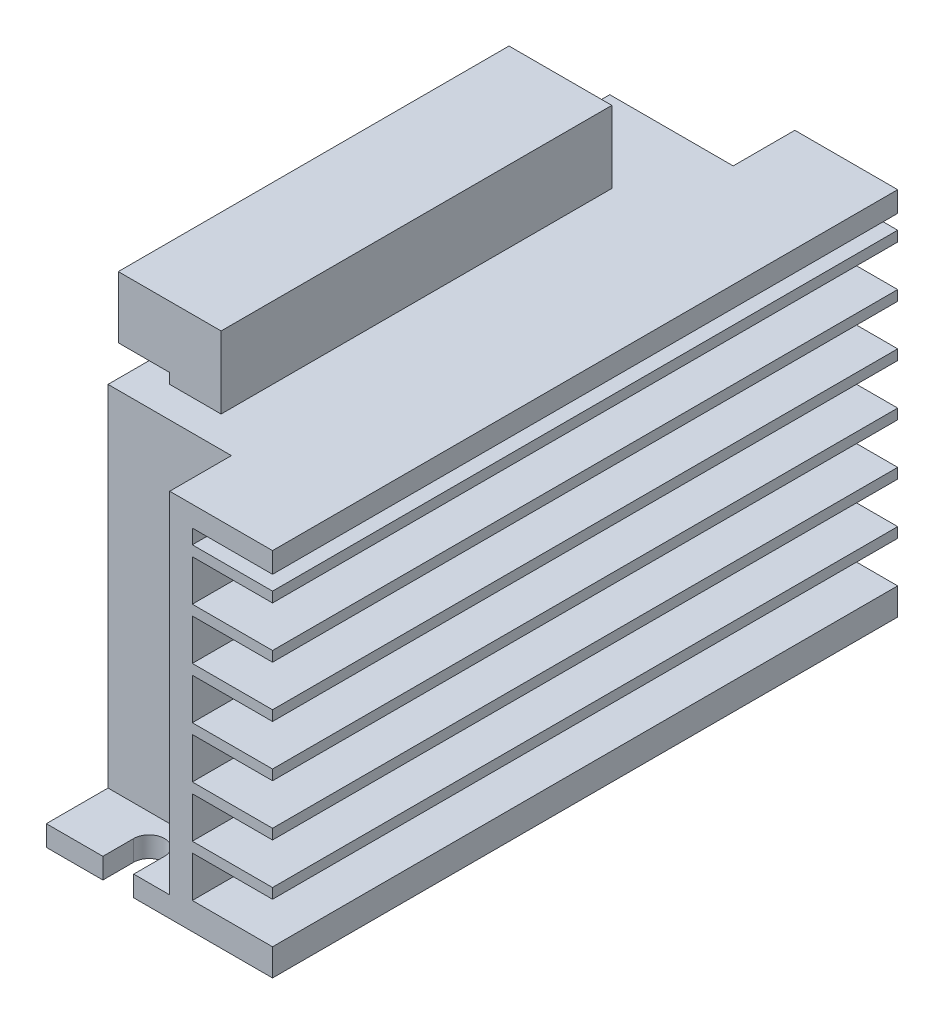
from build123d import *

# Parameters (mm, degrees)
BOSS_EXTRUDE1_DEPTH = 57.15
SKETCH2_W           = 19.05
SKETCH2_H           = 53.975
CUT_EXTRUDE1_DEPTH  = 9.525
SKETCH4_W           = 19.05
SKETCH4_H           = 53.975
CUT_EXTRUDE2_DEPTH  = 9.525
SKETCH5_W           = 12.384603188
SKETCH5_H           = 6.35
SKETCH5_H_2         = 2.244857945
CUT_EXTRUDE3_DEPTH  = 96.52
SKETCH6_W           = 7.9375
SKETCH6_H           = 60.325
BOSS_EXTRUDE2_DEPTH = 1.5875
SKETCH7_W           = 15.875
SKETCH7_H           = 60.325
BOSS_EXTRUDE3_DEPTH = 9.525


with BuildPart() as part:
    # Sketch1 → Boss-Extrude1 (new body)
    with BuildSketch(Plane(origin=(0, 0, 0), x_dir=(1, 0, 0), z_dir=(0, 1, 0))):
        with BuildLine():
            Line((0, 0), (8.73125, 0))
            Line((8.73125, 0), (8.73125, 4.7625))
            ThreePointArc((8.73125, 4.7625), (11.1125, 7.14375), (13.49375, 4.7625))
            Line((13.49375, 4.7625), (13.49375, 0))
            Line((13.49375, 0), (34.925, 0))
            Line((34.925, 0), (34.925, 96.52))
            Line((34.925, 96.52), (13.49375, 96.52))
            Line((13.49375, 96.52), (13.49375, 91.7575))
            ThreePointArc((13.49375, 91.7575), (11.1125, 89.37625), (8.73125, 91.7575))
            Line((8.73125, 91.7575), (8.73125, 96.52))
            Line((8.73125, 96.52), (0, 96.52))
            Line((0, 96.52), (0, 0))
        make_face()
    extrude(amount=BOSS_EXTRUDE1_DEPTH)

    # Sketch2 → Cut-Extrude1 (cut)
    with BuildSketch(Plane.XY):
        with Locations((9.525, 30.1625)):
            Rectangle(SKETCH2_W, SKETCH2_H)
    extrude(amount=-CUT_EXTRUDE1_DEPTH, mode=Mode.SUBTRACT)

    # Sketch4 → Cut-Extrude2 (cut)
    with BuildSketch(Plane(origin=(0, 0, -96.52), x_dir=(-1, 0, 0), z_dir=(0, 0, -1))):
        with Locations((-9.525, 30.1625)):
            Rectangle(SKETCH4_W, SKETCH4_H)
    extrude(amount=-CUT_EXTRUDE2_DEPTH, mode=Mode.SUBTRACT)

    # Sketch5 → Cut-Extrude3 (cut)
    with BuildSketch(Plane(origin=(0, 0, -96.52), x_dir=(-1, 0, 0), z_dir=(0, 0, -1))):
        with Locations((-28.732698406, 7.349133021)):
            Rectangle(SKETCH5_W, SKETCH5_H)
        with Locations((-28.732698406, 15.272834828)):
            Rectangle(SKETCH5_W, SKETCH5_H)
        with Locations((-28.732698406, 23.196536634)):
            Rectangle(SKETCH5_W, SKETCH5_H)
        with Locations((-28.732698406, 31.120238441)):
            Rectangle(SKETCH5_W, SKETCH5_H)
        with Locations((-28.732698406, 39.043940248)):
            Rectangle(SKETCH5_W, SKETCH5_H)
        with Locations((-28.732698406, 46.967642055)):
            Rectangle(SKETCH5_W, SKETCH5_H)
        with Locations((-28.732698406, 52.852571028)):
            Rectangle(SKETCH5_W, SKETCH5_H_2)
    extrude(amount=-CUT_EXTRUDE3_DEPTH, mode=Mode.SUBTRACT)

    # Sketch6 → Boss-Extrude2 (add)
    with BuildSketch(Plane(origin=(0, 57.15, 0), x_dir=(1, 0, 0), z_dir=(0, 1, 0))):
        with Locations((8.73125, 44.448135035)):
            Rectangle(SKETCH6_W, SKETCH6_H)
    extrude(amount=BOSS_EXTRUDE2_DEPTH)

    # Sketch7 → Boss-Extrude3 (add)
    with BuildSketch(Plane(origin=(0, 58.7375, 0), x_dir=(1, 0, 0), z_dir=(0, 1, 0))):
        with Locations((4.7625, 44.448135035)):
            Rectangle(SKETCH7_W, SKETCH7_H)
    extrude(amount=BOSS_EXTRUDE3_DEPTH)


solid = part.part
